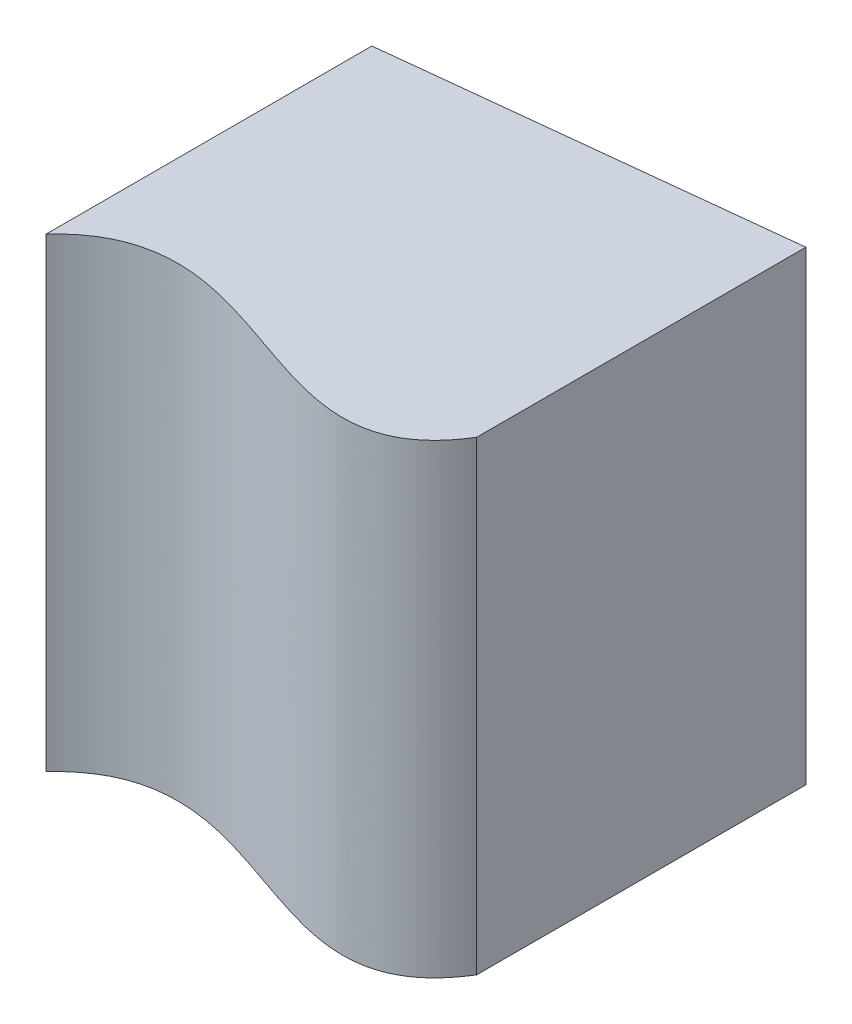
from build123d import *

# Parameters (mm, degrees)
EXTRUDE_1_DEPTH = 131.5


with BuildPart() as part:
    # 草图1 → 凸台-拉伸1 (new, symmetric)
    with BuildSketch(Plane(origin=(0, 0, 0), x_dir=(1, 0, 0), z_dir=(0, 1, 0))):
        with BuildLine():
            Line((-76.837904128, -58.81687225), (-76.837904128, 125.19937152))
            Line((-76.837904128, 125.19937152), (144.166689092, 149.345372478))
            Line((144.166689092, 149.345372478), (144.166689092, -36.597164955))
            add(Edge.make_bspline(
                [(-76.837904128, -58.81687225), (-9.541749974, 14.78234011), (93.359068004, -119.986931913), (144.166689092, -36.597164955)],
                knots=[0, 0, 0, 0, 1, 1, 1, 1], degree=3))
        make_face()
    extrude(amount=EXTRUDE_1_DEPTH, both=True)


solid = part.part
